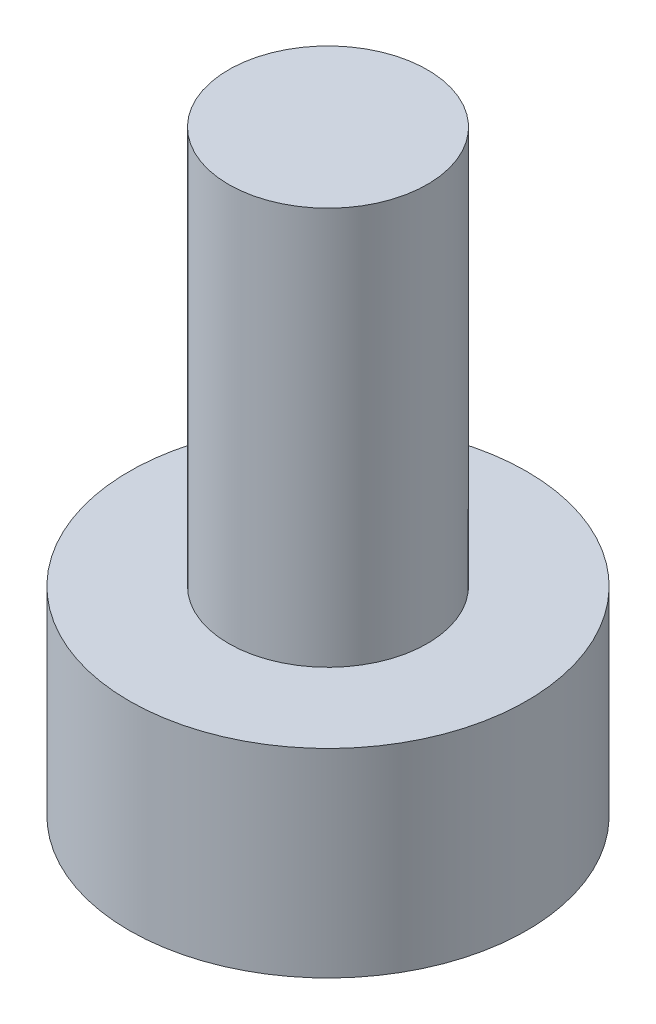
from build123d import *

# Parameters (mm, degrees)
SKETCH_2_R      = 3
EXTRUDE_1_DEPTH = 3
SKETCH_3_R      = 1.5
EXTRUDE_2_DEPTH = 6


with BuildPart() as part:
    # 草图2 → 凸台-拉伸1 (new body)
    with BuildSketch(Plane(origin=(0, 0, 0), x_dir=(1, 0, 0), z_dir=(0, 1, 0))):
        with Locations(Location((0, 0, 0), (0, 0, 270))):
            Circle(SKETCH_2_R)
    extrude(amount=EXTRUDE_1_DEPTH)

    # 草图3 → 凸台-拉伸2 (add)
    with BuildSketch(Plane(origin=(0, 3, 0), x_dir=(1, 0, 0), z_dir=(0, 1, 0))):
        with Locations(Location((0, 0, 0), (0, 0, 270))):
            Circle(SKETCH_3_R)
    extrude(amount=EXTRUDE_2_DEPTH)


solid = part.part
